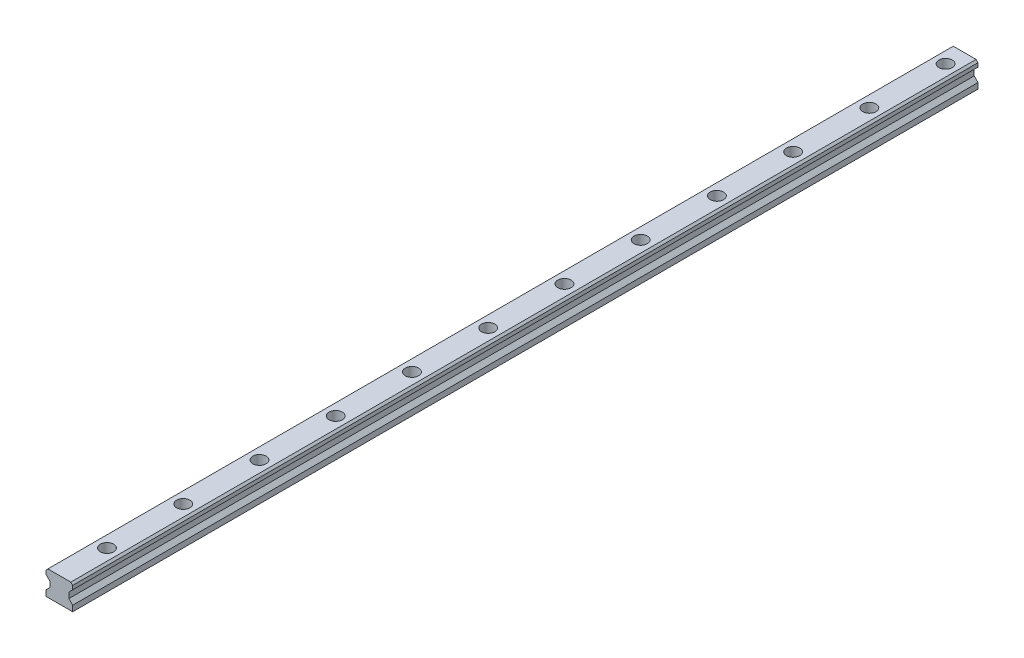
from build123d import *

# Parameters (mm, degrees)
EXTRUDE_1_DEPTH        = 950
CHAMFER_1_SIZE         = 2
SKETCH_2_R             = 7
CUT_EXTRUDE_1_DEPTH    = 12
PATTERN_LINEAR_1_COUNT = 12
PATTERN_LINEAR_1_PITCH = 80
SKETCH_3_R             = 4.5
CUT_EXTRUDE_2_DEPTH    = 40
PATTERN_LINEAR_2_COUNT = 12
PATTERN_LINEAR_2_PITCH = 80


with BuildPart() as part:
    # 草图1 → 凸台-拉伸1 (new body)
    with BuildSketch(Plane.XY):
        Polygon((-14, 0), (14, 0), (14, 6), (10, 10), (10, 16), (14, 20), (14, 26), (-14, 26), (-14, 20), (-10, 16), (-10, 10), (-14, 6), align=None)
    extrude(amount=EXTRUDE_1_DEPTH)

    # 倒角1
    chamfer_1_edges = [part.edges().sort_by_distance(p)[0] for p in [
        (-14, 26, 475),
        (14, 26, 475),
    ]]
    chamfer(chamfer_1_edges, length=CHAMFER_1_SIZE)

    # 草图2 → 切除-拉伸1 (cut)
    with BuildSketch(Plane(origin=(0, 26, 0), x_dir=(1, 0, 0), z_dir=(0, 1, 0))):
        with Locations(Location((0, -20, 0), (0, 0, 270))):
            Circle(SKETCH_2_R)
    cut_extrude_1 = extrude(amount=-CUT_EXTRUDE_1_DEPTH, mode=Mode.SUBTRACT)

    # 阵列(线性)1: 切除-拉伸1 ×12
    with Locations(*[(0, 0, i * PATTERN_LINEAR_1_PITCH) for i in range(1, PATTERN_LINEAR_1_COUNT)]):
        add(cut_extrude_1, mode=Mode.SUBTRACT)

    # 草图3 → 切除-拉伸2 (cut)
    with BuildSketch(Plane(origin=(0, 26, 0), x_dir=(1, 0, 0), z_dir=(0, 1, 0))):
        with Locations(Location((0, -20, 0), (0, 0, 270))):
            Circle(SKETCH_3_R)
    cut_extrude_2 = extrude(amount=-CUT_EXTRUDE_2_DEPTH, mode=Mode.SUBTRACT)

    # 阵列(线性)2: 切除-拉伸2 ×12
    with Locations(*[(0, 0, i * PATTERN_LINEAR_2_PITCH) for i in range(1, PATTERN_LINEAR_2_COUNT)]):
        add(cut_extrude_2, mode=Mode.SUBTRACT)


solid = part.part
